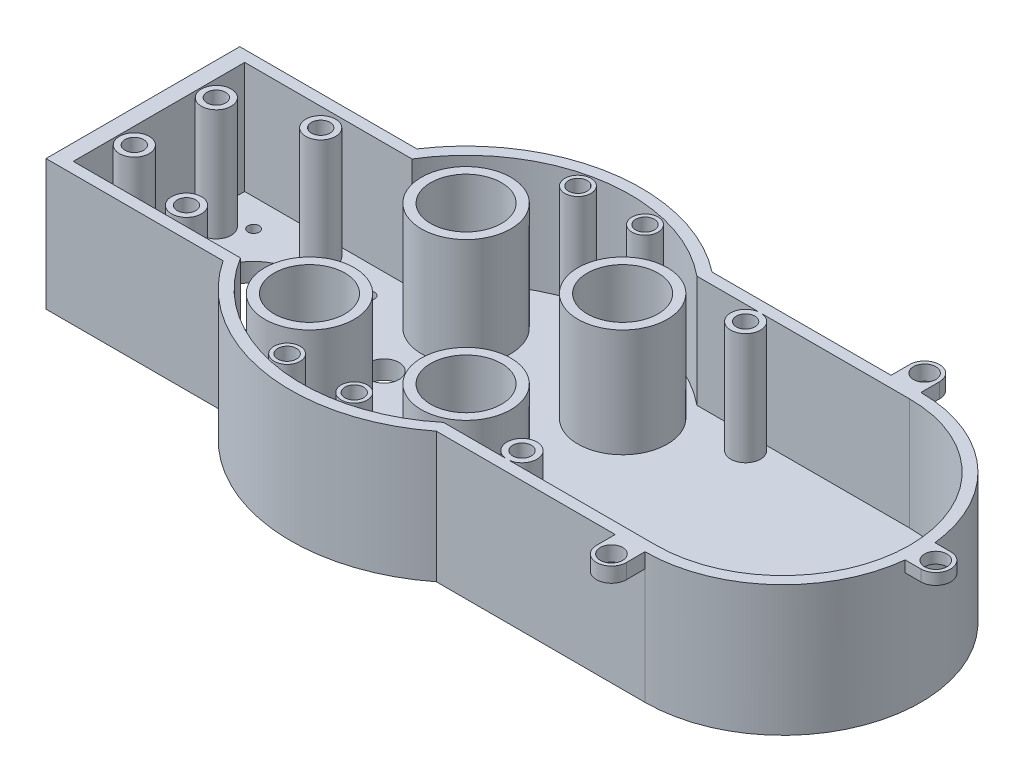
from build123d import *

# Parameters (mm, degrees)
BOSS_EXTRUDE3_DEPTH = 35
SKETCH1_8_R         = 4.99771167
BOSS_EXTRUDE4_DEPTH = 5
CUT_EXTRUDE1_DEPTH  = 10
BOSS_EXTRUDE5_START = -3
SKETCH22_R          = 3
BOSS_EXTRUDE5_DEPTH = 3
SKETCH2_R           = 12
SKETCH2_R_2         = 9.5
BOSS_EXTRUDE6_DEPTH = 29
SKETCH23_R          = 2.999999999
SKETCH23_R_2        = 3
BOSS_EXTRUDE7_DEPTH = 4
SKETCH11_R          = 11.25
SKETCH11_R_2        = 1.5
CUT_EXTRUDE2_DEPTH  = 20
SKETCH24_R          = 4
SKETCH24_R_2        = 2.5
SKETCH24_R_3        = 3.5
SKETCH24_R_4        = 2.500018474
BOSS_EXTRUDE8_DEPTH = 30


with BuildPart() as part:
    # Sketch1 → Boss-Extrude3 (new body)
    with BuildSketch(Plane(origin=(0, 0, 0), x_dir=(1, 0, 0), z_dir=(0, 1, 0))):
        with BuildLine():
            Line((-39.195031893, 25.988113322), (-86.695031893, 25.988113322))
            Line((-86.695031893, 25.988113322), (-86.695031893, -0.001886678))
            Line((-86.695031893, -0.001886678), (-86.695031893, -25.991886678))
            Line((-86.695031893, -25.991886678), (-39.189227367, -25.991886678))
            ThreePointArc((-39.189227367, -25.991886678), (-7.506053104, -46.403541136), (28.985180603, -36.977564703))
            Line((28.985180603, -36.977564703), (84.985180603, -36.999994064))
            ThreePointArc((84.985180603, -36.999994064), (122.000000001, 2.968e-06), (84.985180603, 37))
            Line((84.985180603, 37), (28.985180603, 36.977570638))
            ThreePointArc((28.985180603, 36.977570638), (-7.510107434, 46.404944207), (-39.195031893, 25.988113322))
        make_face()
        with BuildLine():
            Line((-82.377665867, -22.999994064), (-82.377665867, -0.001612142))
            Line((-82.377665867, -0.001612142), (-82.377665867, 22.997385422))
            Line((-82.377665867, 22.997385422), (-37.507775535, 22.997385422))
            ThreePointArc((-37.507775535, 22.997385422), (-7.280719209, 43.388716375), (27.945855319, 33.977565588))
            Line((27.945855319, 33.977565588), (84.985180603, 34.000907476))
            ThreePointArc((84.985180603, 34.000907476), (119.000007777, -2.847e-06), (84.985180603, -34.00091317))
            Line((84.985180603, -34.00091317), (27.938898317, -33.977568435))
            ThreePointArc((27.938898317, -33.977568435), (-7.29337461, -43.394145047), (-37.526858967, -22.999994064))
            Line((-37.526858967, -22.999994064), (-82.377665867, -22.999994064))
        make_face(mode=Mode.SUBTRACT)
    extrude(amount=BOSS_EXTRUDE3_DEPTH)

    # Sketch22 → Boss-Extrude5 (add)
    with BuildSketch(Plane(origin=(0, 35, 0), x_dir=(1, 0, 0), z_dir=(0, 1, 0)).offset(BOSS_EXTRUDE5_START)):
        with BuildLine():
            ThreePointArc((126, -4), (130, 0), (126, 4))
            Line((126, 4), (121.783148639, 4))
            ThreePointArc((121.783148639, 4), (122.000000001, -1.7e-08), (121.783147994, -4))
            Line((121.783147994, -4), (126, -4))
        make_face()
        with Locations((126, 0)):
            Circle(SKETCH22_R, mode=Mode.SUBTRACT)
    extrude(amount=BOSS_EXTRUDE5_DEPTH)


with BuildPart() as body_2:
    # Sketch1<8> → Boss-Extrude4 (new body)
    with BuildSketch(Plane(origin=(0, 0, 0), x_dir=(1, 0, 0), z_dir=(0, 1, 0))):
        with BuildLine():
            Line((-82.377665867, 22.997385422), (-82.377665867, -0.001612142))
            Line((-82.377665867, -0.001612142), (-82.377665867, -22.999994064))
            Line((-82.377665867, -22.999994064), (-37.526858967, -22.999994064))
            ThreePointArc((-37.526858967, -22.999994064), (-7.29337461, -43.394145047), (27.938898317, -33.977568435))
            Line((27.938898317, -33.977568435), (84.985180603, -34.00091317))
            ThreePointArc((84.985180603, -34.00091317), (119.000007777, -2.847e-06), (84.985180603, 34.000907476))
            Line((84.985180603, 34.000907476), (27.945855319, 33.977565588))
            ThreePointArc((27.945855319, 33.977565588), (-7.280719209, 43.388716375), (-37.507775535, 22.997385422))
            Line((-37.507775535, 22.997385422), (-82.377665867, 22.997385422))
        make_face()
        with Locations((-20.990389016, -20.990389016)):
            Circle(SKETCH1_8_R, mode=Mode.SUBTRACT)
        with BuildLine():
            ThreePointArc((-17.991762014, 0), (-21.98993135, -3.998169336), (-25.988100686, 0))
            ThreePointArc((-25.988100686, 0), (-21.98993135, 3.998169336), (-17.991762014, 0))
        make_face(mode=Mode.SUBTRACT)
        with Locations((20.990389016, -20.990389016)):
            Circle(SKETCH1_8_R, mode=Mode.SUBTRACT)
        with Locations((-20.990389016, 20.990389016)):
            Circle(SKETCH1_8_R, mode=Mode.SUBTRACT)
        with Locations((20.990389016, 20.990389016)):
            Circle(SKETCH1_8_R, mode=Mode.SUBTRACT)
    extrude(amount=BOSS_EXTRUDE4_DEPTH)

    # Sketch3 → Cut-Extrude1 (cut)
    with BuildSketch(Plane(origin=(0, 5, 0), x_dir=(1, 0, 0), z_dir=(0, 1, 0))):
        with BuildLine():
            Line((-2.5, -13), (-2.5, -8))
            ThreePointArc((-2.5, -8), (0, -5.5), (2.5, -8))
            Line((2.5, -8), (2.5, -13))
            ThreePointArc((2.5, -13), (0, -15.5), (-2.5, -13))
        make_face()
        with BuildLine():
            Line((-2.5, 13), (-2.5, 8))
            ThreePointArc((-2.5, 8), (0, 5.5), (2.5, 8))
            Line((2.5, 8), (2.5, 13))
            ThreePointArc((2.5, 13), (0, 15.5), (-2.5, 13))
        make_face()
    extrude(amount=-CUT_EXTRUDE1_DEPTH, mode=Mode.SUBTRACT)


    add(part.part)  # Boss-Extrude6 merges part
    # Sketch2 → Boss-Extrude6 (add)
    # profile 1 of 4: a face of its own
    with BuildSketch(Plane(origin=(0, 5, 0), x_dir=(1, 0, 0), z_dir=(0, 1, 0))):
        with Locations((-21, 21)):
            Circle(SKETCH2_R)
        with Locations((-21, 21)):
            Circle(SKETCH2_R_2, mode=Mode.SUBTRACT)
    # profile 2 of 4: a face of its own
    with BuildSketch(Plane(origin=(0, 5, 0), x_dir=(1, 0, 0), z_dir=(0, 1, 0))):
        with Locations((-21, -21)):
            Circle(SKETCH2_R)
        with Locations((-21, -21)):
            Circle(SKETCH2_R_2, mode=Mode.SUBTRACT)
    # profile 3 of 4: a face of its own
    with BuildSketch(Plane(origin=(0, 5, 0), x_dir=(1, 0, 0), z_dir=(0, 1, 0))):
        with Locations((21, -21)):
            Circle(SKETCH2_R)
        with Locations((21, -21)):
            Circle(SKETCH2_R_2, mode=Mode.SUBTRACT)
    # profile 4 of 4: a face of its own
    with BuildSketch(Plane(origin=(0, 5, 0), x_dir=(1, 0, 0), z_dir=(0, 1, 0))):
        with Locations((21, 21)):
            Circle(SKETCH2_R)
        with Locations((21, 21)):
            Circle(SKETCH2_R_2, mode=Mode.SUBTRACT)
    extrude(amount=BOSS_EXTRUDE6_DEPTH)

    # Sketch23 → Boss-Extrude7 (add)
    # profile 1 of 2: a face of its own
    with BuildSketch(Plane(origin=(0, 35, 0), x_dir=(1, 0, 0), z_dir=(0, 1, 0))):
        with BuildLine():
            ThreePointArc((84.985180603, 37), (84.992590302, 37.000002226), (85.000000001, 37.000002968))
            Line((85.000000001, 37.000002968), (85.000000001, 42))
            ThreePointArc((85.000000001, 42), (81.000000001, 46.000000001), (77, 42))
            Line((77, 42), (77, 36.996801741))
            Line((77, 36.996801741), (84.985180603, 37))
        make_face()
        with Locations((81.000000001, 42)):
            Circle(SKETCH23_R, mode=Mode.SUBTRACT)
    # profile 2 of 2: a face of its own
    with BuildSketch(Plane(origin=(0, 35, 0), x_dir=(1, 0, 0), z_dir=(0, 1, 0))):
        with BuildLine():
            Line((77, -36.996795805), (77, -42))
            ThreePointArc((77, -42), (81.000000001, -46.000000001), (85.000000001, -42))
            Line((85.000000001, -42), (84.985180603, -36.999994064))
            Line((84.985180603, -36.999994064), (77, -36.996795805))
        make_face()
        with Locations((81.000000001, -42)):
            Circle(SKETCH23_R_2, mode=Mode.SUBTRACT)
    extrude(amount=-BOSS_EXTRUDE7_DEPTH)

    # Sketch11 → Cut-Extrude2 (cut)
    with BuildSketch(Plane(origin=(0, 5, 0), x_dir=(1, 0, 0), z_dir=(0, 1, 0))):
        with Locations((-57, 0.008103654)):
            Circle(SKETCH11_R)
        with Locations((-72.5, 15.5)):
            Circle(SKETCH11_R_2)
        with Locations((-41.5, 15.5)):
            Circle(SKETCH11_R_2)
        with Locations((-41.5, -15.5)):
            Circle(SKETCH11_R_2)
        with Locations((-72.5, -15.5)):
            Circle(SKETCH11_R_2)
    extrude(amount=-CUT_EXTRUDE2_DEPTH, mode=Mode.SUBTRACT)

    # Sketch24 → Boss-Extrude8 (add)
    # profile 1 of 10: a face of its own
    with BuildSketch(Plane(origin=(0, 5, 0), x_dir=(1, 0, 0), z_dir=(0, 1, 0))):
        with Locations((-78, 11)):
            Circle(SKETCH24_R)
        with Locations((-78, 11)):
            Circle(SKETCH24_R_2, mode=Mode.SUBTRACT)
    # profile 2 of 10: a face of its own
    with BuildSketch(Plane(origin=(0, 5, 0), x_dir=(1, 0, 0), z_dir=(0, 1, 0))):
        with Locations((-78, -11)):
            Circle(SKETCH24_R)
        with Locations((-78, -11)):
            Circle(SKETCH24_R_2, mode=Mode.SUBTRACT)
    # profile 3 of 10: a face of its own
    with BuildSketch(Plane(origin=(0, 5, 0), x_dir=(1, 0, 0), z_dir=(0, 1, 0))):
        with Locations((-57, -18)):
            Circle(SKETCH24_R)
        with Locations((-57, -18)):
            Circle(SKETCH24_R_2, mode=Mode.SUBTRACT)
    # profile 4 of 10: a face of its own
    with BuildSketch(Plane(origin=(0, 5, 0), x_dir=(1, 0, 0), z_dir=(0, 1, 0))):
        with Locations((-57, 18)):
            Circle(SKETCH24_R)
        with Locations((-57, 18)):
            Circle(SKETCH24_R_2, mode=Mode.SUBTRACT)
    # profile 5 of 10: a face of its own
    with BuildSketch(Plane(origin=(0, 5, 0), x_dir=(1, 0, 0), z_dir=(0, 1, 0))):
        with Locations((-9, 39)):
            Circle(SKETCH24_R_3)
        with Locations((-9, 39)):
            Circle(SKETCH24_R_2, mode=Mode.SUBTRACT)
    # profile 6 of 10: a face of its own
    with BuildSketch(Plane(origin=(0, 5, 0), x_dir=(1, 0, 0), z_dir=(0, 1, 0))):
        with Locations((-9, -39)):
            Circle(SKETCH24_R_3)
        with Locations((-9, -39)):
            Circle(SKETCH24_R_2, mode=Mode.SUBTRACT)
    # profile 7 of 10: a face of its own
    with BuildSketch(Plane(origin=(0, 5, 0), x_dir=(1, 0, 0), z_dir=(0, 1, 0))):
        with Locations((9, 39)):
            Circle(SKETCH24_R_3)
        with Locations((9, 39)):
            Circle(SKETCH24_R_2, mode=Mode.SUBTRACT)
    # profile 8 of 10: a face of its own
    with BuildSketch(Plane(origin=(0, 5, 0), x_dir=(1, 0, 0), z_dir=(0, 1, 0))):
        with Locations((9, -39)):
            Circle(SKETCH24_R_3)
        with Locations((9, -39)):
            Circle(SKETCH24_R_2, mode=Mode.SUBTRACT)
    # profile 9 of 10: a face of its own
    with BuildSketch(Plane(origin=(0, 5, 0), x_dir=(1, 0, 0), z_dir=(0, 1, 0))):
        with BuildLine():
            ThreePointArc((44.829954146, 33.984474975), (45.00215934, 25.988113657), (45.167819864, 33.984613237))
            Line((45.167819864, 33.984613237), (44.829954146, 33.984474975))
        make_face()
        with Locations((45.000522442, 29.988113322)):
            Circle(SKETCH24_R_2, mode=Mode.SUBTRACT)
    # profile 10 of 10: a face of its own
    with BuildSketch(Plane(origin=(0, 5, 0), x_dir=(1, 0, 0), z_dir=(0, 1, 0))):
        with BuildLine():
            ThreePointArc((45.458576581, -33.984737916), (45.001112501, -25.991887014), (44.537106836, -33.984360828))
            Line((44.537106836, -33.984360828), (45.458576581, -33.984737916))
        make_face()
        with Locations((44.999471671, -30.001497662)):
            Circle(SKETCH24_R_4, mode=Mode.SUBTRACT)
    extrude(amount=BOSS_EXTRUDE8_DEPTH)


solid = body_2.part
